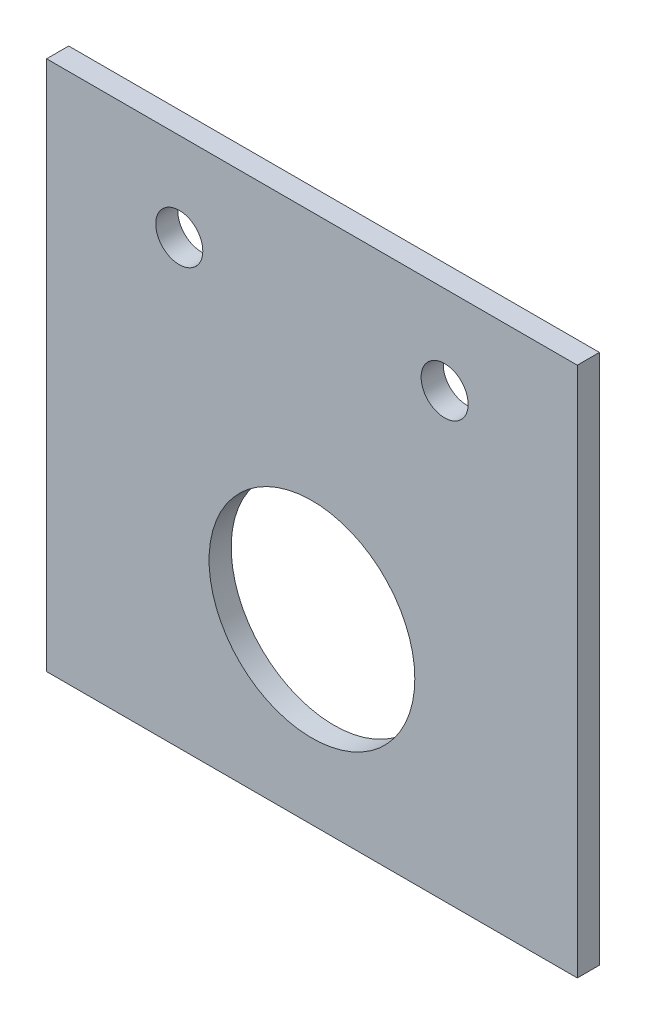
from build123d import *

# Parameters (mm, degrees)
SKETCH1_W               = 76.2
SKETCH1_H               = 76.2
BOSS_EXTRUDE1_DEPTH     = 3.175
F_1_4_CLEARANCE_HOLE1_D = 6.7564
CUT_EXTRUDE1_DEPTH      = 54.975
CUT_EXTRUDE1_DEPTH_BACK = 54.975
SKETCH4_R               = 14.77


with BuildPart() as part:
    # Sketch1 → Boss-Extrude1 (new body)
    with BuildSketch(Plane.XY):
        Rectangle(SKETCH1_W, SKETCH1_H)
    extrude(amount=BOSS_EXTRUDE1_DEPTH)

    # 1/4 Clearance Hole1 (through all)
    with Locations(Plane.XY.offset(3.175)):
        with Locations((19.05, 25.4), (-19.05, 25.4)):
            Hole(F_1_4_CLEARANCE_HOLE1_D / 2)

    # Sketch4 → Cut-Extrude1 (cut, two sides: drawn at the far end of the back side and taken through both)
    with BuildSketch(Plane.XY.offset(3.175).offset(-CUT_EXTRUDE1_DEPTH_BACK)):
        with Locations((0, -12.552196451)):
            Circle(SKETCH4_R)
    extrude(amount=CUT_EXTRUDE1_DEPTH + CUT_EXTRUDE1_DEPTH_BACK, mode=Mode.SUBTRACT)


solid = part.part
